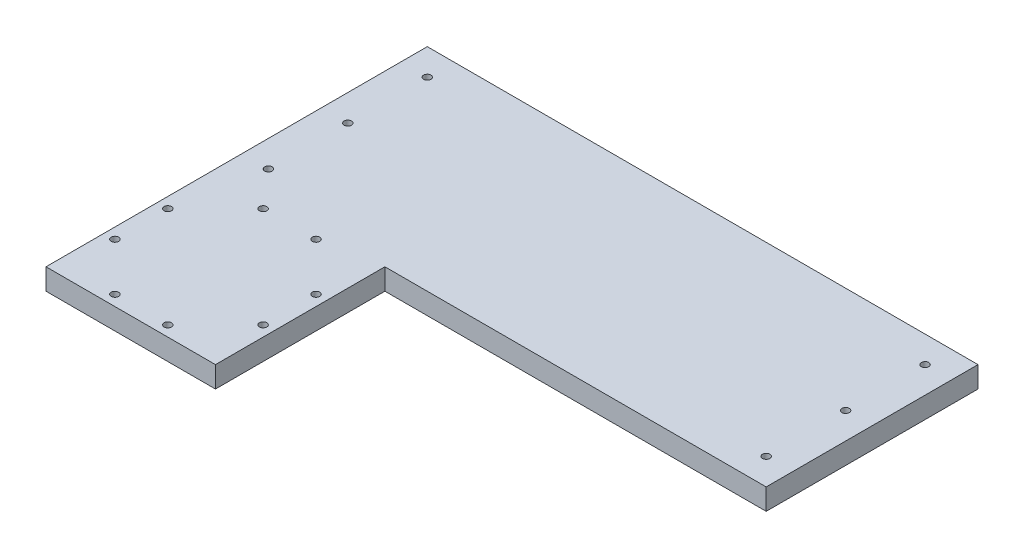
from build123d import *

# Parameters (mm, degrees)
SKETCH1_W                      = 520
SKETCH1_H                      = 200
BOSS_EXTRUDE1_DEPTH            = 20
SKETCH6_W                      = 160
SKETCH6_H                      = 160
BOSS_EXTRUDE2_DEPTH            = 20
CBORE_FOR_M6_SHCS1_AT_2_COUNT  = 2
CBORE_FOR_M6_SHCS1_AT_2_PITCH  = 150
CBORE_FOR_M6_SHCS1_AT_3_COUNT  = 2
CBORE_FOR_M6_SHCS1_AT_3_PITCH  = 470
CBORE_FOR_M6_SHCS1_AT_4_COUNT  = 2
CBORE_FOR_M6_SHCS1_AT_4_PITCH  = 493.355855342
CBORE_FOR_M6_SHCS1_AT_5_COUNT  = 2
CBORE_FOR_M6_SHCS1_AT_5_PITCH  = 75
CBORE_FOR_M6_SHCS1_AT_6_COUNT  = 2
CBORE_FOR_M6_SHCS1_AT_6_PITCH  = 475.946425556
CBORE_FOR_M6_SHCS1_AT_7_COUNT  = 2
CBORE_FOR_M6_SHCS1_AT_7_PITCH  = 507.666228934
CBORE_FOR_M6_SHCS1_AT_8_COUNT  = 2
CBORE_FOR_M6_SHCS1_AT_8_PITCH  = 547.014625033
CBORE_FOR_M6_SHCS1_AT_9_COUNT  = 2
CBORE_FOR_M6_SHCS1_AT_9_PITCH  = 431.653796462
CBORE_FOR_M6_SHCS1_AT_10_COUNT = 2
CBORE_FOR_M6_SHCS1_AT_10_PITCH = 477.310171691
CBORE_FOR_M6_SHCS1_AT_11_COUNT = 2
CBORE_FOR_M6_SHCS1_AT_11_PITCH = 414.638396678
CBORE_FOR_M6_SHCS1_AT_12_COUNT = 2
CBORE_FOR_M6_SHCS1_AT_12_PITCH = 536.77276384
CBORE_FOR_M6_SHCS1_AT_13_COUNT = 2
CBORE_FOR_M6_SHCS1_AT_13_PITCH = 560.022320984
CBORE_FOR_M6_SHCS1_AT_14_COUNT = 2
CBORE_FOR_M6_SHCS1_AT_14_PITCH = 444.325331261


with BuildPart() as part:
    # Sketch1 → Boss-Extrude1 (new body)
    with BuildSketch(Plane(origin=(0, 0, 0), x_dir=(1, 0, 0), z_dir=(0, 1, 0))):
        Rectangle(SKETCH1_W, SKETCH1_H)
    extrude(amount=BOSS_EXTRUDE1_DEPTH)

    # Sketch6 → Boss-Extrude2 (add)
    with BuildSketch(Plane.XZ):
        with Locations((-180, 180)):
            Rectangle(SKETCH6_W, SKETCH6_H)
    extrude(amount=-BOSS_EXTRUDE2_DEPTH)

    # Sketch5 → CBORE for M6 SHCS1 (revolve, cut)
    with BuildSketch(Plane(origin=(235, 0, -75), x_dir=(0, 0, -1), z_dir=(1, 0, 0))):
        Polygon((0, 0), (0, 20), (3.5, 20), (3.5, 6), (5.5, 6), (5.5, 0.020977491), (5.525, 0), align=None)
    cbore_for_m6_shcs1 = revolve(axis=Axis((235, -6.35, -75), (0, 1, 0)), mode=Mode.SUBTRACT)

    # CBORE for M6 SHCS1 at 2: CBORE for M6 SHCS1 ×2
    with Locations(*[(0, 0, i * CBORE_FOR_M6_SHCS1_AT_2_PITCH) for i in range(1, CBORE_FOR_M6_SHCS1_AT_2_COUNT)]):
        add(cbore_for_m6_shcs1, mode=Mode.SUBTRACT)

    # CBORE for M6 SHCS1 at 3: CBORE for M6 SHCS1 ×2
    with Locations(*[(-i * CBORE_FOR_M6_SHCS1_AT_3_PITCH, 0, 0) for i in range(1, CBORE_FOR_M6_SHCS1_AT_3_COUNT)]):
        add(cbore_for_m6_shcs1, mode=Mode.SUBTRACT)

    # CBORE for M6 SHCS1 at 4: CBORE for M6 SHCS1 ×2
    with Locations(*[Vector(-0.9526592112186828, 0, 0.30404017379319653) * (i * CBORE_FOR_M6_SHCS1_AT_4_PITCH) for i in range(1, CBORE_FOR_M6_SHCS1_AT_4_COUNT)]):
        add(cbore_for_m6_shcs1, mode=Mode.SUBTRACT)

    # CBORE for M6 SHCS1 at 5: CBORE for M6 SHCS1 ×2
    with Locations(*[(0, 0, i * CBORE_FOR_M6_SHCS1_AT_5_PITCH) for i in range(1, CBORE_FOR_M6_SHCS1_AT_5_COUNT)]):
        add(cbore_for_m6_shcs1, mode=Mode.SUBTRACT)

    # CBORE for M6 SHCS1 at 6: CBORE for M6 SHCS1 ×2
    with Locations(*[Vector(-0.9875061031301207, 0, 0.15758076113778519) * (i * CBORE_FOR_M6_SHCS1_AT_6_PITCH) for i in range(1, CBORE_FOR_M6_SHCS1_AT_6_COUNT)]):
        add(cbore_for_m6_shcs1, mode=Mode.SUBTRACT)

    # CBORE for M6 SHCS1 at 7: CBORE for M6 SHCS1 ×2
    with Locations(*[Vector(-0.7682212795973759, 0, 0.6401843996644799) * (i * CBORE_FOR_M6_SHCS1_AT_7_PITCH) for i in range(1, CBORE_FOR_M6_SHCS1_AT_7_COUNT)]):
        add(cbore_for_m6_shcs1, mode=Mode.SUBTRACT)

    # CBORE for M6 SHCS1 at 8: CBORE for M6 SHCS1 ×2
    with Locations(*[Vector(-0.8043660623762138, 0, 0.594134023346067) * (i * CBORE_FOR_M6_SHCS1_AT_8_PITCH) for i in range(1, CBORE_FOR_M6_SHCS1_AT_8_COUNT)]):
        add(cbore_for_m6_shcs1, mode=Mode.SUBTRACT)

    # CBORE for M6 SHCS1 at 9: CBORE for M6 SHCS1 ×2
    with Locations(*[Vector(-0.9035018415143107, 0, 0.42858420687217297) * (i * CBORE_FOR_M6_SHCS1_AT_9_PITCH) for i in range(1, CBORE_FOR_M6_SHCS1_AT_9_COUNT)]):
        add(cbore_for_m6_shcs1, mode=Mode.SUBTRACT)

    # CBORE for M6 SHCS1 at 10: CBORE for M6 SHCS1 ×2
    with Locations(*[Vector(-0.9218324395662549, 0, 0.3875886393630844) * (i * CBORE_FOR_M6_SHCS1_AT_10_PITCH) for i in range(1, CBORE_FOR_M6_SHCS1_AT_10_COUNT)]):
        add(cbore_for_m6_shcs1, mode=Mode.SUBTRACT)

    # CBORE for M6 SHCS1 at 11: CBORE for M6 SHCS1 ×2
    with Locations(*[Vector(-0.8320502943378436, 0, 0.5547001962252293) * (i * CBORE_FOR_M6_SHCS1_AT_11_PITCH) for i in range(1, CBORE_FOR_M6_SHCS1_AT_11_COUNT)]):
        add(cbore_for_m6_shcs1, mode=Mode.SUBTRACT)

    # CBORE for M6 SHCS1 at 12: CBORE for M6 SHCS1 ×2
    with Locations(*[Vector(-0.9035480796952873, 0, 0.42848671820601264) * (i * CBORE_FOR_M6_SHCS1_AT_12_PITCH) for i in range(1, CBORE_FOR_M6_SHCS1_AT_12_COUNT)]):
        add(cbore_for_m6_shcs1, mode=Mode.SUBTRACT)

    # CBORE for M6 SHCS1 at 13: CBORE for M6 SHCS1 ×2
    with Locations(*[Vector(-0.8660369092932877, 0, 0.49998007134457856) * (i * CBORE_FOR_M6_SHCS1_AT_13_PITCH) for i in range(1, CBORE_FOR_M6_SHCS1_AT_13_COUNT)]):
        add(cbore_for_m6_shcs1, mode=Mode.SUBTRACT)

    # CBORE for M6 SHCS1 at 14: CBORE for M6 SHCS1 ×2
    with Locations(*[Vector(-0.7764580943901146, 0, 0.6301688882006727) * (i * CBORE_FOR_M6_SHCS1_AT_14_PITCH) for i in range(1, CBORE_FOR_M6_SHCS1_AT_14_COUNT)]):
        add(cbore_for_m6_shcs1, mode=Mode.SUBTRACT)


solid = part.part
